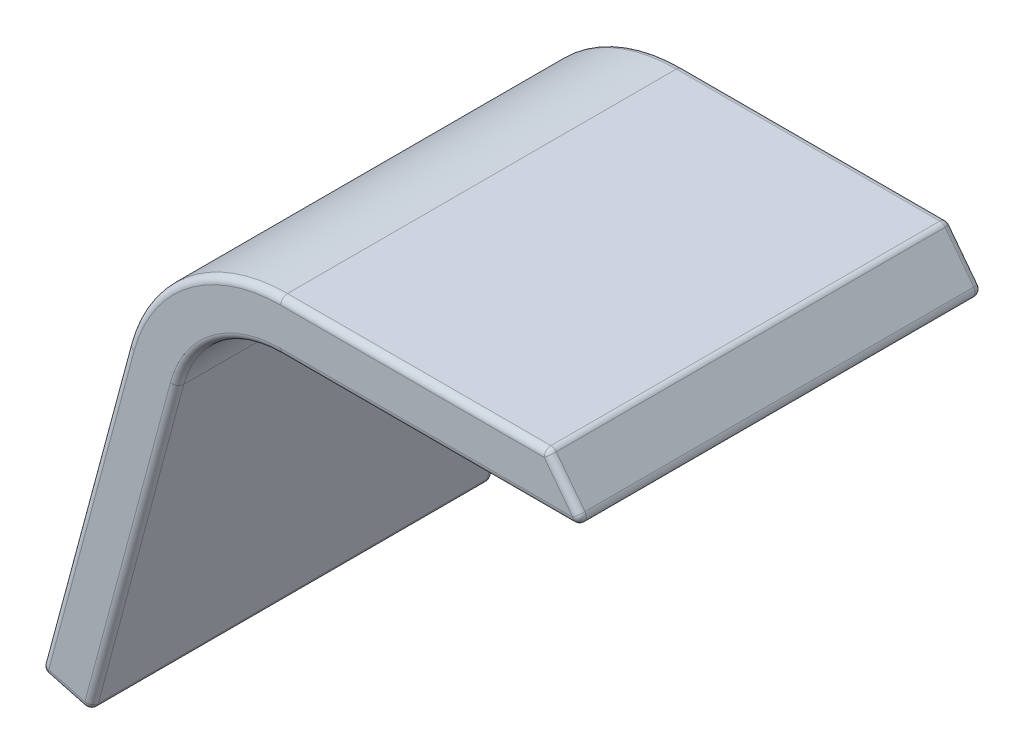
from build123d import *

# Parameters (mm, degrees)
BOSS_EXTRUDE1_DEPTH = 296
FILLET1_R           = 10


with BuildPart() as part:
    # Sketch1 → Boss-Extrude1 (new, symmetric)
    with BuildSketch(Plane.XY):
        with BuildLine():
            Line((-225, 75), (-225, 0))
            ThreePointArc((-225, 0), (-321.184305783, -32.650172234), (-377.616280554, -117.106590874))
            Line((-377.616280554, -117.106590874), (-450.060717525, -97.695162491))
            ThreePointArc((-450.060717525, -97.695162491), (-366.841412959, 26.851328288), (-225, 75))
        make_face()
        Polygon((167.450475902, 75), (-225, 75), (-225, 0), (225, 0), align=None)
        Polygon((-578.434963896, -576.79437233), (-505.990526925, -596.205800713), (-377.616280554, -117.106590874), (-450.060717525, -97.695162491), align=None)
    extrude(amount=BOSS_EXTRUDE1_DEPTH, both=True)

    # Fillet1
    fillet1_edges = [part.edges().sort_by_distance(p)[0] for p in [
        (0, 0, 296),
        (-542.21274541, -586.500086522, -296),
        (-514.247840711, -337.244767411, -296),
        (-366.841412959, 26.851328288, -296),
        (-28.774762049, 75, -296),
        (196.225237951, 37.5, -296),
        (0, 0, -296),
        (-321.184305783, -32.650172234, -296),
        (196.225237951, 37.5, 296),
        (-505.990526925, -596.205800713, 0),
        (-578.434963896, -576.79437233, 0),
        (167.450475902, 75, 0),
        (225, 0, 0),
        (-28.774762049, 75, 296),
        (-366.841412959, 26.851328288, 296),
        (-514.247840711, -337.244767411, 296),
        (-542.21274541, -586.500086522, 296),
        (-441.803403739, -356.656195793, 296),
        (-321.184305783, -32.650172234, 296),
        (-441.803403739, -356.656195793, -296),
    ]]
    fillet(fillet1_edges, radius=FILLET1_R)


solid = part.part
